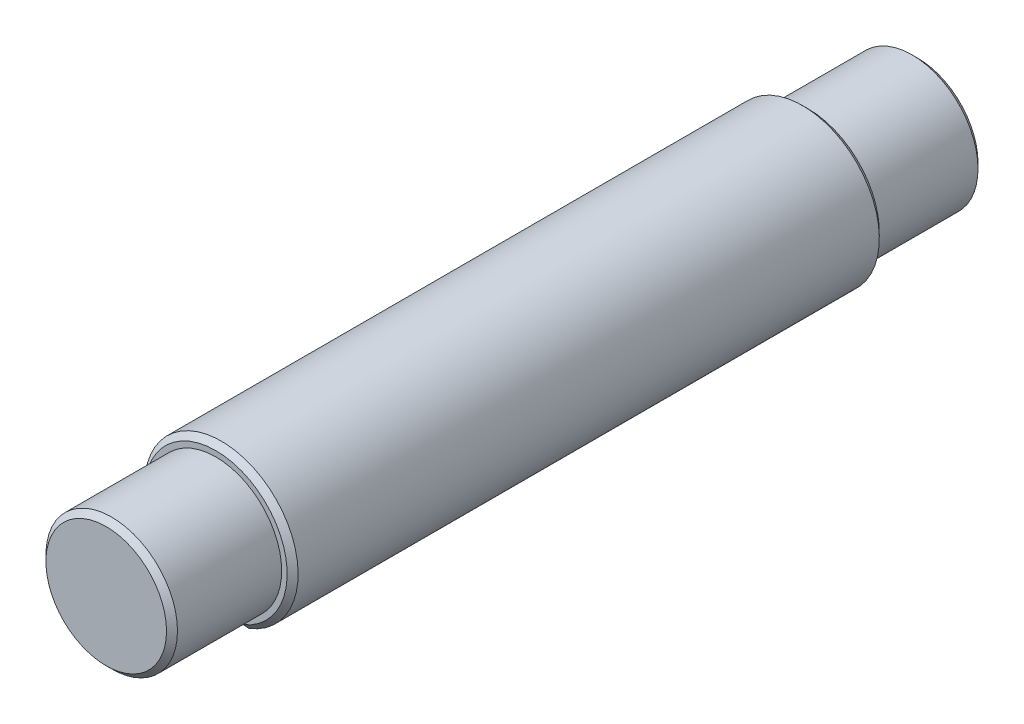
from build123d import *

# Parameters (mm, degrees)
SKETCH1_R      = 7
EXTRUDE1_DEPTH = 37
EXTRUDE3_START = -4
EXTRUDE3_DEPTH = 35.301436004
SKETCH4_R      = 7
SKETCH4_R_2    = 6
EXTRUDE4_DEPTH = 10
CHAMFER1_SIZE  = 0.5


with BuildPart() as part:
    # Sketch1 → Extrude1 (new, symmetric)
    with BuildSketch(Plane.XY):
        Circle(SKETCH1_R)
    extrude(amount=EXTRUDE1_DEPTH, both=True)

    # Sketch3 → Extrude3 (cut, through all)
    with BuildSketch(Plane(origin=(0, 0, 0), x_dir=(1, 0, 0), z_dir=(0, 1, 0)).offset(EXTRUDE3_START)):
        with BuildLine():
            Line((-2.5, -27), (-2.5, 27))
            ThreePointArc((-2.5, 27), (0, 29.5), (2.5, 27))
            Line((2.5, 27), (2.5, -27))
            ThreePointArc((2.5, -27), (0, -29.5), (-2.5, -27))
        make_face()
    extrude(amount=-EXTRUDE3_DEPTH, mode=Mode.SUBTRACT)

    # Sketch4 → Extrude4 (cut)
    with BuildSketch(Plane.XY.offset(37)):
        with Locations(Location((0, 0, 0), (0, 0, 249.075167572))):
            Circle(SKETCH4_R)
        Circle(SKETCH4_R_2, mode=Mode.SUBTRACT)
    extrude4 = extrude(amount=-EXTRUDE4_DEPTH, mode=Mode.SUBTRACT)

    # Mirror1: Extrude4 across plane
    add(extrude4.mirror(Plane.XY), mode=Mode.SUBTRACT)

    # Chamfer1
    chamfer1_edges = [part.edges().sort_by_distance(p)[0] for p in [
        (0, 7, 27),
        (-6, 0, 37),
        (0, 7, -27),
        (-6, 0, -37),
    ]]
    chamfer(chamfer1_edges, length=CHAMFER1_SIZE)


solid = part.part
